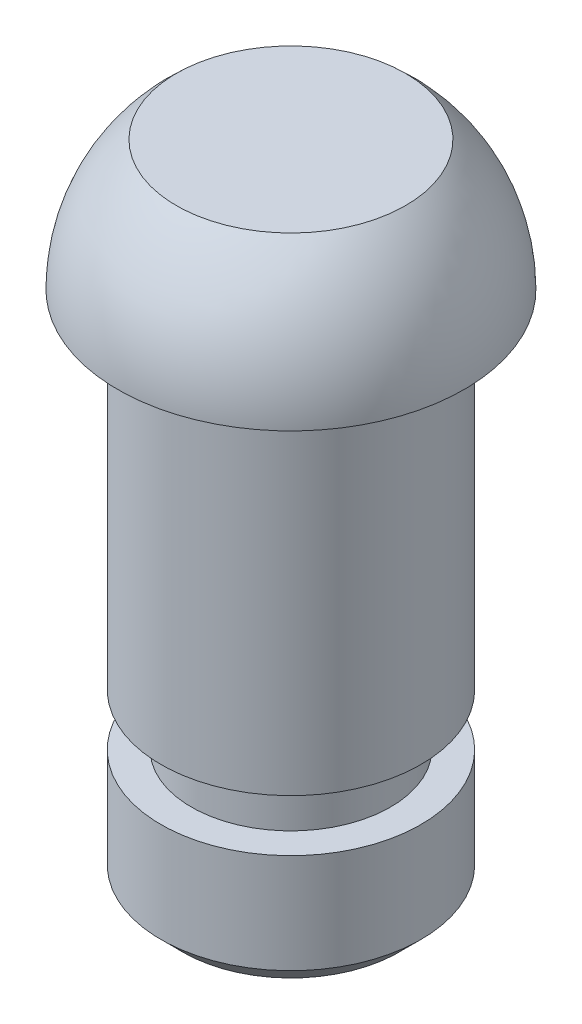
from build123d import *

# Parameters (mm, degrees)
CHAMFER1_SIZE = 0.25


with BuildPart() as part:
    # Sketch4 → Revolve11 (revolve)
    with BuildSketch(Plane.XY, mode=Mode.PRIVATE) as revolve11_sk:
        with BuildLine():
            Line((0, 0), (0, 6))
            Line((0, 6), (0, 7.5))
            Line((0, 7.5), (1.322875656, 7.5))
            ThreePointArc((1.322875656, 7.5), (1.822875656, 6.822875656), (2, 6))
            Line((2, 6), (1.5, 6))
            Line((1.5, 6), (1.5, 2))
            Line((1.5, 2), (1.15, 2))
            Line((1.15, 2), (1.15, 1.4))
            Line((1.15, 1.4), (1.5, 1.4))
            Line((1.5, 1.4), (1.5, 0))
            Line((1.5, 0), (0, 0))
        make_face()
    revolve(revolve11_sk.sketch.rotate(Axis((0, 0, 0), (0, 1, 0)), 90), axis=Axis((0, 0, 0), (0, 1, 0)))

    # Chamfer1
    chamfer1_edges = [part.edges().sort_by_distance(p)[0] for p in [
        (0, 0, 1.5),
    ]]
    chamfer(chamfer1_edges, length=CHAMFER1_SIZE)


solid = part.part
